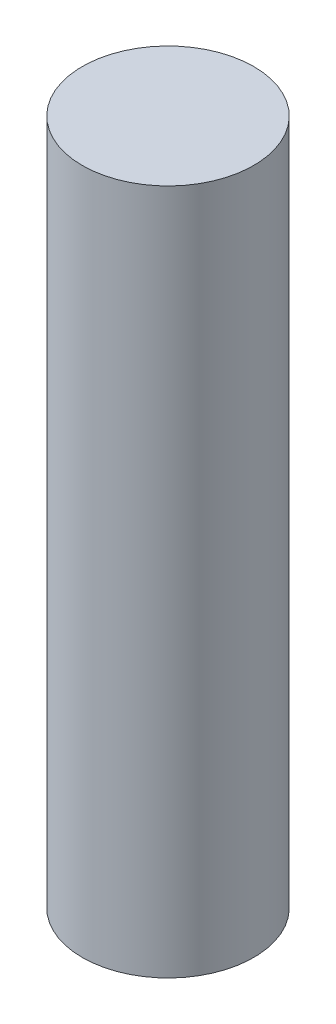
from build123d import *

# Parameters (mm, degrees)
SKETCH1_R           = 9.525
BOSS_EXTRUDE1_DEPTH = 76.2


with BuildPart() as part:
    # Sketch1 → Boss-Extrude1 (new body)
    with BuildSketch(Plane(origin=(0, 0, 0), x_dir=(1, 0, 0), z_dir=(0, 1, 0))):
        with Locations(Location((0, 0, 0), (0, 0, 90))):
            Circle(SKETCH1_R)
    extrude(amount=BOSS_EXTRUDE1_DEPTH)


solid = part.part
